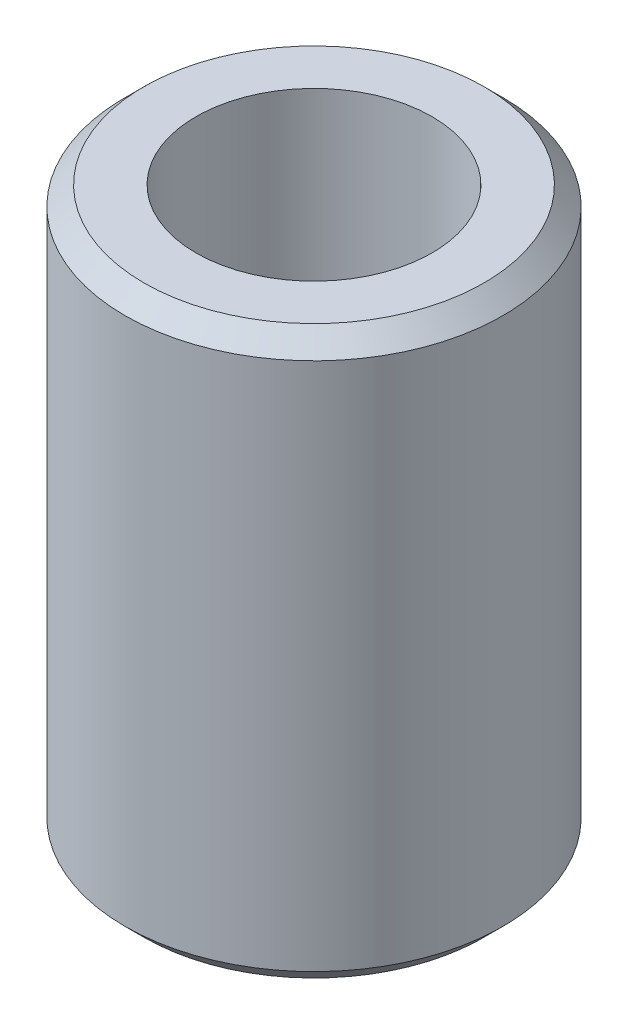
from build123d import *

# Parameters (mm, degrees)
SKETCH1_R           = 20
SKETCH1_R_2         = 12.5
BOSS_EXTRUDE1_DEPTH = 60
CHAMFER1_SIZE       = 2


with BuildPart() as part:
    # Sketch1 → Boss-Extrude1 (new body)
    with BuildSketch(Plane(origin=(0, 0, 0), x_dir=(1, 0, 0), z_dir=(0, 1, 0))):
        with Locations(Location((0, 0, 0), (0, 0, 270))):
            Circle(SKETCH1_R)
        with Locations(Location((0, 0, 0), (0, 0, 270))):
            Circle(SKETCH1_R_2, mode=Mode.SUBTRACT)
    extrude(amount=BOSS_EXTRUDE1_DEPTH)

    # Chamfer1
    chamfer1_edges = [part.edges().sort_by_distance(p)[0] for p in [
        (0, 0, -20),
        (0, 60, -20),
    ]]
    chamfer(chamfer1_edges, length=CHAMFER1_SIZE)


solid = part.part
